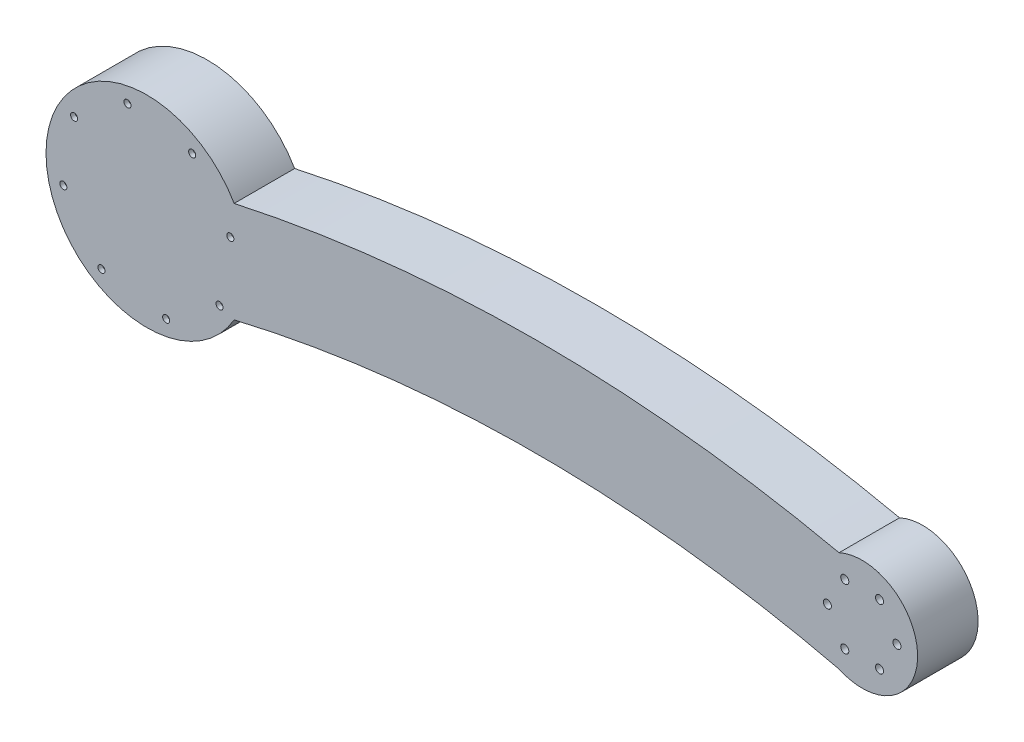
from build123d import *

# Parameters (mm, degrees)
EXTRUDE_3_DEPTH     = 30
CUT_EXTRUDE_1_DEPTH = 27.75
SKETCH_5_R          = 1.75
CUT_EXTRUDE_2_DEPTH = 250.931131666
SKETCH_6_R          = 2
CUT_EXTRUDE_3_DEPTH = 251.190943233


with BuildPart() as part:
    # 草图1 → 凸台-拉伸3 (new body)
    with BuildSketch(Plane.XY):
        with BuildLine():
            ThreePointArc((188.956439237, 0), (176.309013441, 23.14413618), (150, 25))
            Line((150, 25), (150, -25))
            ThreePointArc((150, -25), (176.309013441, -23.14413618), (188.956439237, 0))
        make_face()
        with BuildLine():
            Line((150, -25), (150, 25))
            ThreePointArc((150, 25), (133.956439237, 0), (150, -25))
        make_face()
        with BuildLine():
            ThreePointArc((188.956439237, 0), (176.309013441, 23.14413618), (150, 25))
            Line((150, 25), (150, -25))
            ThreePointArc((150, -25), (176.309013441, -23.14413618), (188.956439237, 0))
        make_face()
        with BuildLine():
            Line((150, -25), (150, 25))
            ThreePointArc((150, 25), (133.956439237, 0), (150, -25))
        make_face()
        with BuildLine():
            Line((150, 25), (-150, 25))
            ThreePointArc((-150, 25), (-145.004978875, 12.940952255), (-143.301270189, 0))
            ThreePointArc((-143.301270189, 0), (-145.004978875, -12.940952255), (-150, -25))
            ThreePointArc((-150, -25), (0, -7.455532034), (150, -25))
            ThreePointArc((150, -25), (133.956439237, 0), (150, 25))
        make_face()
        with BuildLine():
            ThreePointArc((-150, 25), (0, 41.260283441), (150, 25))
            Line((150, 25), (-150, 25))
        make_face()
        with BuildLine():
            ThreePointArc((-143.301270189, 0), (-145.004978875, 12.940952255), (-150, 25))
            Line((-150, 25), (-150, -25))
            ThreePointArc((-150, -25), (-145.004978875, -12.940952255), (-143.301270189, 0))
        make_face()
        with BuildLine():
            Line((-150, -25), (-150, 25))
            ThreePointArc((-150, 25), (-243.301270189, 0), (-150, -25))
        make_face()
        with BuildLine():
            ThreePointArc((-143.301270189, 0), (-145.004978875, 12.940952255), (-150, 25))
            Line((-150, 25), (-150, -25))
            ThreePointArc((-150, -25), (-145.004978875, -12.940952255), (-143.301270189, 0))
        make_face()
        with BuildLine():
            Line((-150, -25), (-150, 25))
            ThreePointArc((-150, 25), (-243.301270189, 0), (-150, -25))
        make_face()
    extrude(amount=EXTRUDE_3_DEPTH)

    # 草图3 → 切除-拉伸1 (cut)
    with BuildSketch(Plane(origin=(0, 0, 0), x_dir=(-1, 0, 0), z_dir=(0, 0, -1))):
        with BuildLine():
            ThreePointArc((241.460241998, 2.962420354), (203.950254971, 47.06019149), (151.10937756, 23.40740687))
            Line((151.10937756, 23.40740687), (145.115292459, -2.484763599))
            ThreePointArc((145.115292459, -2.484763599), (182.186192507, -46.952290127), (235.258997062, -23.8246019))
            Line((235.258997062, -23.8246019), (238.35961953, -10.431090773))
            Line((238.35961953, -10.431090773), (241.460241998, 2.962420354))
        make_face()
    extrude(amount=-CUT_EXTRUDE_1_DEPTH, mode=Mode.SUBTRACT)

    # 草图5 → 切除-拉伸2 (cut, through all)
    with BuildSketch(Plane(origin=(0, 0, 27.75), x_dir=(-1, 0, 0), z_dir=(0, 0, -1))):
        with Locations((151.896300525, 9.585326657)):
            Circle(SKETCH_5_R)
        with Locations((170.801384844, 36.055584303)):
            Circle(SKETCH_5_R)
        with Locations((202.886596846, 41.404969664)):
            Circle(SKETCH_5_R)
        with Locations((229.356854492, 22.499885346)):
            Circle(SKETCH_5_R)
        with Locations((234.706239853, -9.585326656)):
            Circle(SKETCH_5_R)
        with Locations((215.801155535, -36.055584303)):
            Circle(SKETCH_5_R)
        with Locations((183.715943533, -41.404969664)):
            Circle(SKETCH_5_R)
        with Locations((157.245685886, -22.499885346)):
            Circle(SKETCH_5_R)
    extrude(amount=-CUT_EXTRUDE_2_DEPTH, mode=Mode.SUBTRACT)

    # 草图6 → 切除-拉伸3 (cut, through all)
    with BuildSketch(Plane.XY.offset(30)):
        with Locations((178.706439237, 0)):
            Circle(SKETCH_6_R)
        with Locations((170.081439237, -14.938938215)):
            Circle(SKETCH_6_R)
        with Locations((152.831439237, -14.938938215)):
            Circle(SKETCH_6_R)
        with Locations((144.206439237, 0)):
            Circle(SKETCH_6_R)
        with Locations((152.831439237, 14.938938215)):
            Circle(SKETCH_6_R)
        with Locations((170.081439237, 14.938938215)):
            Circle(SKETCH_6_R)
    extrude(amount=-CUT_EXTRUDE_3_DEPTH, mode=Mode.SUBTRACT)


solid = part.part
